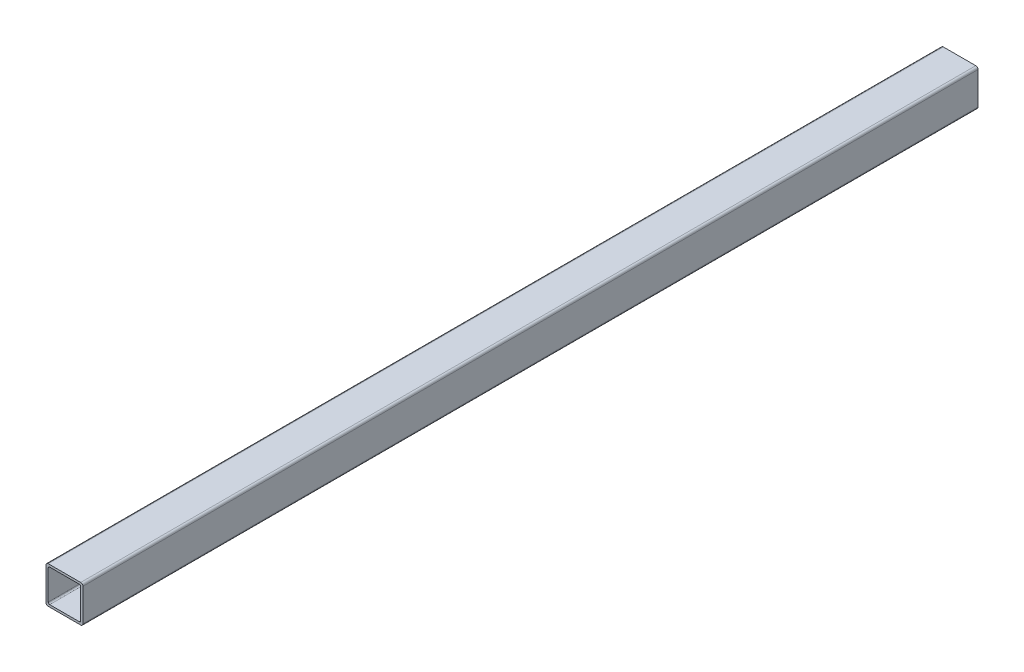
from build123d import *

# Parameters (mm, degrees)
EXTRUDE_1_DEPTH = 2425


with BuildPart() as part:
    # Эскиз1 → Бобышка-Вытянуть1 (new body)
    with BuildSketch(Plane.XY):
        with BuildLine():
            Line((6, 100), (94, 100))
            ThreePointArc((94, 100), (98.242640687, 98.242640687), (100, 94))
            Line((100, 94), (100, 6))
            ThreePointArc((100, 6), (98.242640687, 1.757359313), (94, 0))
            Line((94, 0), (6, 0))
            ThreePointArc((6, 0), (1.757359313, 1.757359313), (0, 6))
            Line((0, 6), (0, 94))
            ThreePointArc((0, 94), (1.757359313, 98.242640687), (6, 100))
        make_face()
        with BuildLine():
            Line((10, 94), (90, 94))
            ThreePointArc((90, 94), (92.828427125, 92.828427125), (94, 90))
            Line((94, 90), (94, 10))
            ThreePointArc((94, 10), (92.828427125, 7.171572875), (90, 6))
            Line((90, 6), (10, 6))
            ThreePointArc((10, 6), (7.171572875, 7.171572875), (6, 10))
            Line((6, 10), (6, 90))
            ThreePointArc((6, 90), (7.171572875, 92.828427125), (10, 94))
        make_face(mode=Mode.SUBTRACT)
    extrude(amount=EXTRUDE_1_DEPTH)


solid = part.part
